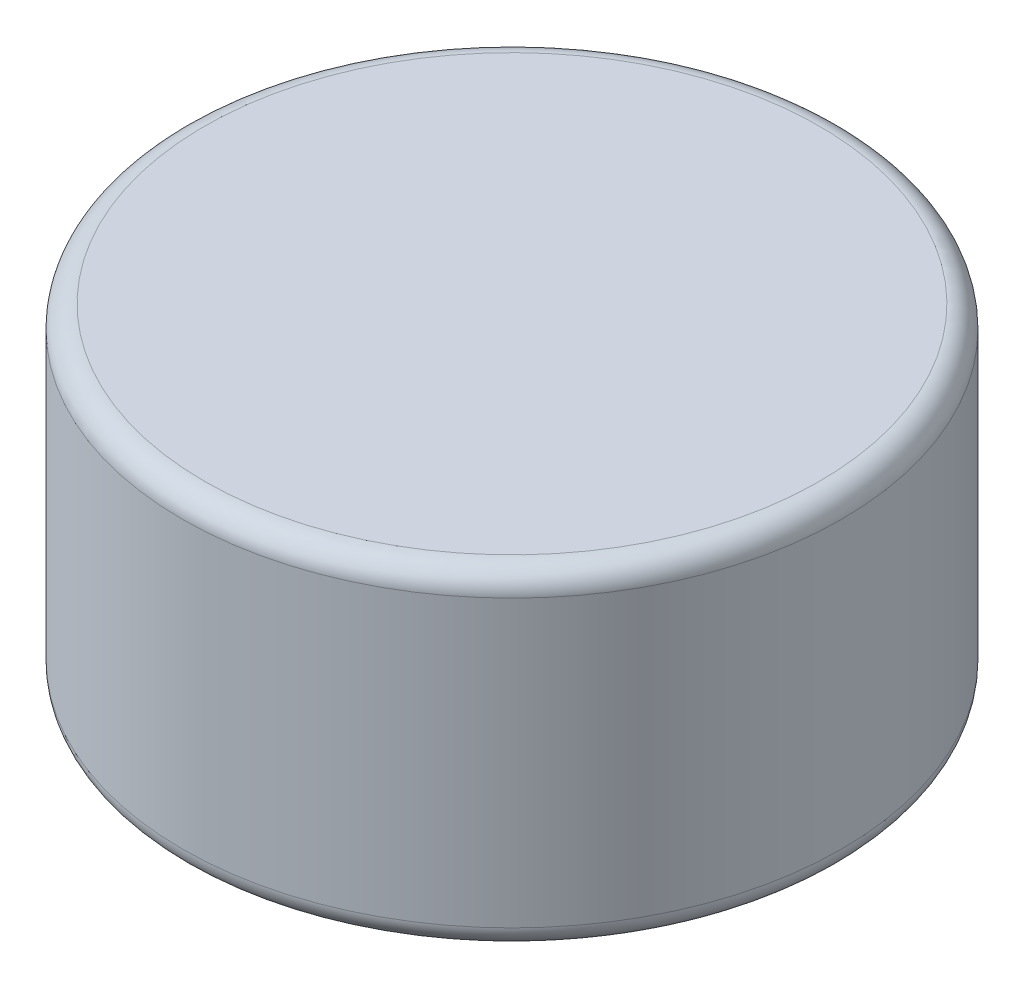
from build123d import *

# Parameters (mm, degrees)
SZKIC1_R                    = 3
DODANIE_WYCI_GNI_CIE1_DEPTH = 3
ZAOKR_GLENIE1_R             = 0.2


with BuildPart() as part:
    # Szkic1 → Dodanie-wyciągnięcie1 (new body)
    with BuildSketch(Plane(origin=(0, 0, 0), x_dir=(1, 0, 0), z_dir=(0, 1, 0))):
        with Locations(Location((0, 0, 0), (0, 0, 270))):
            Circle(SZKIC1_R)
    extrude(amount=DODANIE_WYCI_GNI_CIE1_DEPTH)

    # Zaokrąglenie1
    zaokr_glenie1_edges = [part.edges().sort_by_distance(p)[0] for p in [
        (0, 0, -3),
        (0, 3, -3),
    ]]
    fillet(zaokr_glenie1_edges, radius=ZAOKR_GLENIE1_R)


solid = part.part
